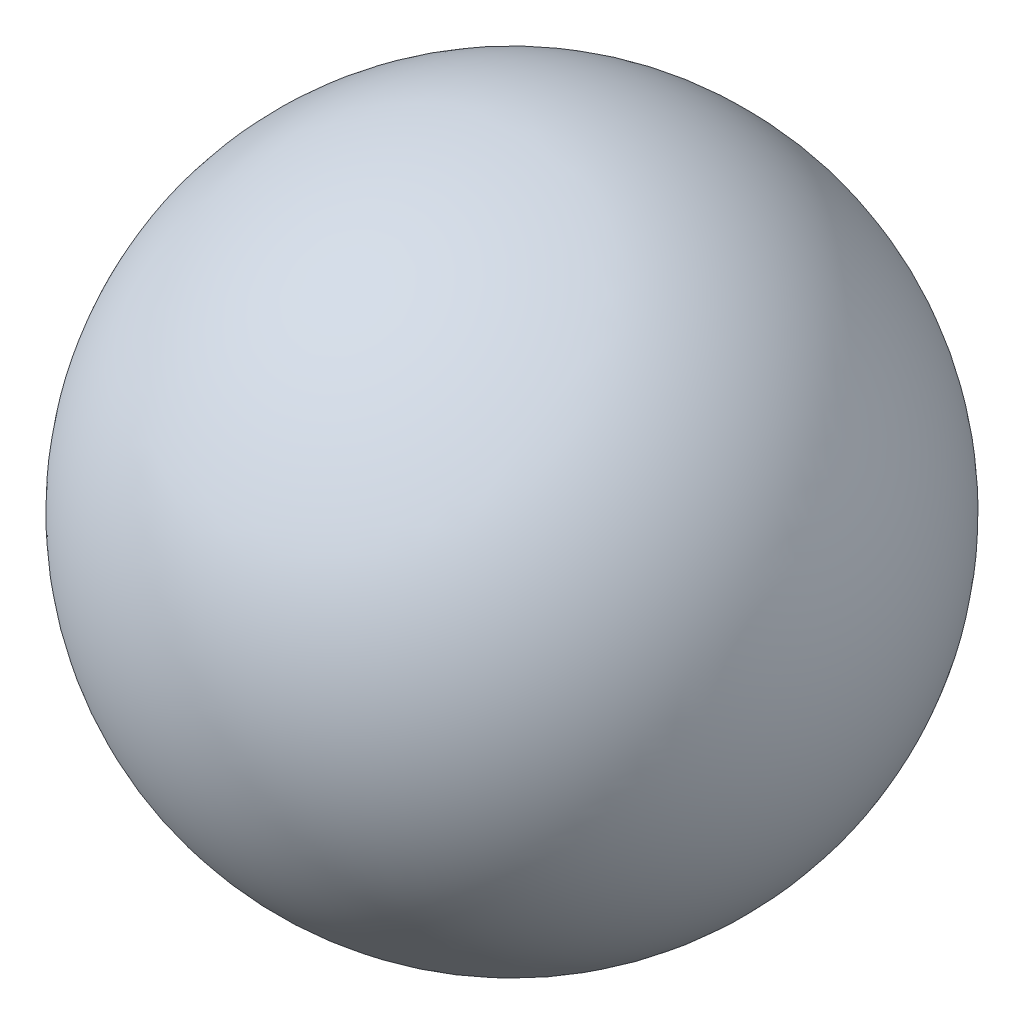
from build123d import *


with BuildPart() as part:
    # Schizzo1 → Rivoluzione1 (revolve)
    with BuildSketch(Plane.XY):
        with BuildLine():
            Line((10.072, 53.75), (2.928, 53.75))
            ThreePointArc((2.928, 53.75), (6.5, 57.322), (10.072, 53.75))
        make_face()
    revolve(axis=Axis((10.072, 53.75, 0), (-1, 0, 0)))


solid = part.part
